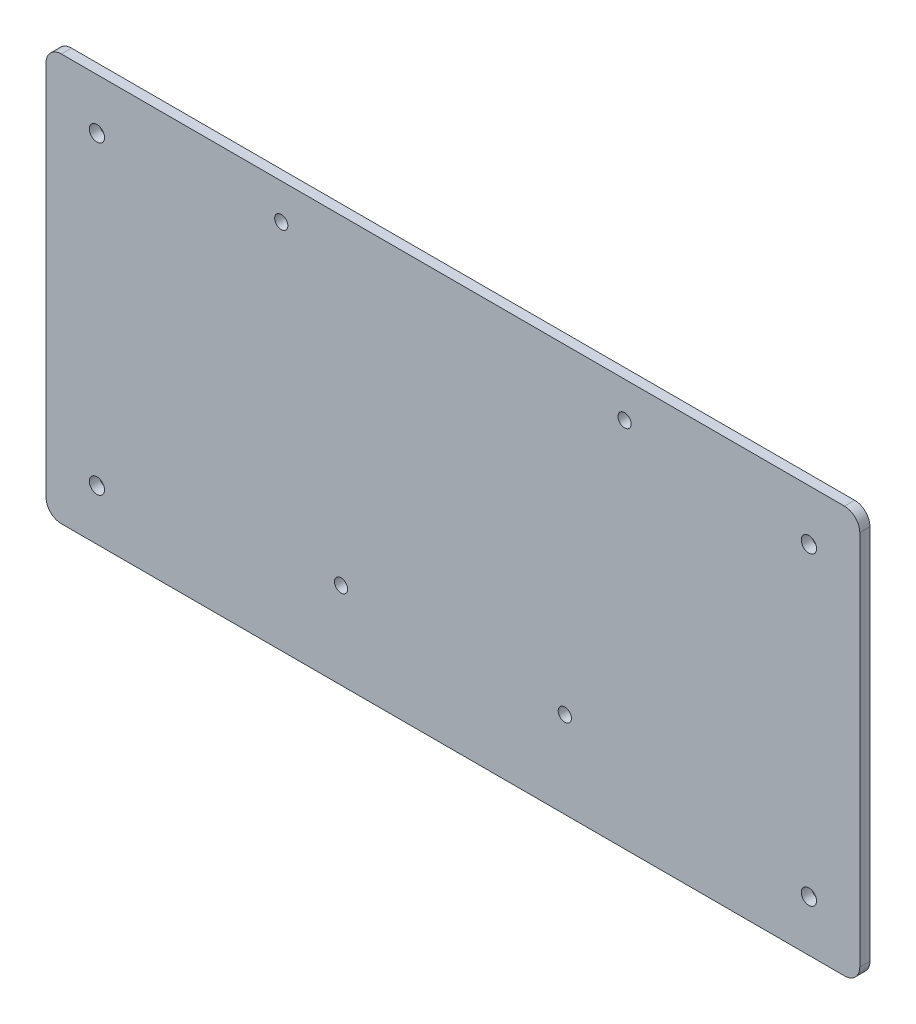
from build123d import *

# Parameters (mm, degrees)
SKETCH_1_W          = 160
SKETCH_1_H          = 80
EXTRUDE_1_DEPTH     = 2
SKETCH_2_R          = 1.3
CUT_EXTRUDE_1_DEPTH = 90.465076985
SKETCH_7_R          = 1.5
CUT_EXTRUDE_3_DEPTH = 90.465076985
FILLET_1_R          = 3


with BuildPart() as part:
    # 草图1 → 凸台-拉伸1 (new body)
    with BuildSketch(Plane.XY):
        Rectangle(SKETCH_1_W, SKETCH_1_H)
    extrude(amount=EXTRUDE_1_DEPTH)

    # 草图2 → 切除-拉伸1 (cut, through all)
    with BuildSketch(Plane.XY.offset(2)):
        with Locations((-33.75, 33)):
            Circle(SKETCH_2_R)
        with Locations((33.75, 33)):
            Circle(SKETCH_2_R)
        with Locations((-22, -23)):
            Circle(SKETCH_2_R)
        with Locations((22, -23)):
            Circle(SKETCH_2_R)
    extrude(amount=-CUT_EXTRUDE_1_DEPTH, mode=Mode.SUBTRACT)

    # 草图7 → 切除-拉伸3 (cut, through all)
    with BuildSketch(Plane(origin=(0, 0, 0), x_dir=(-1, 0, 0), z_dir=(0, 0, -1))):
        with Locations((-70, -30)):
            Circle(SKETCH_7_R)
        with Locations((-70, 30)):
            Circle(SKETCH_7_R)
        with Locations((70, 30)):
            Circle(SKETCH_7_R)
        with Locations((70, -30)):
            Circle(SKETCH_7_R)
    extrude(amount=-CUT_EXTRUDE_3_DEPTH, mode=Mode.SUBTRACT)

    # 圆角1
    fillet_1_edges = [part.edges().sort_by_distance(p)[0] for p in [
        (-80, -40, 1),
        (-80, 40, 1),
        (80, 40, 1),
        (80, -40, 1),
    ]]
    fillet(fillet_1_edges, radius=FILLET_1_R)


solid = part.part
